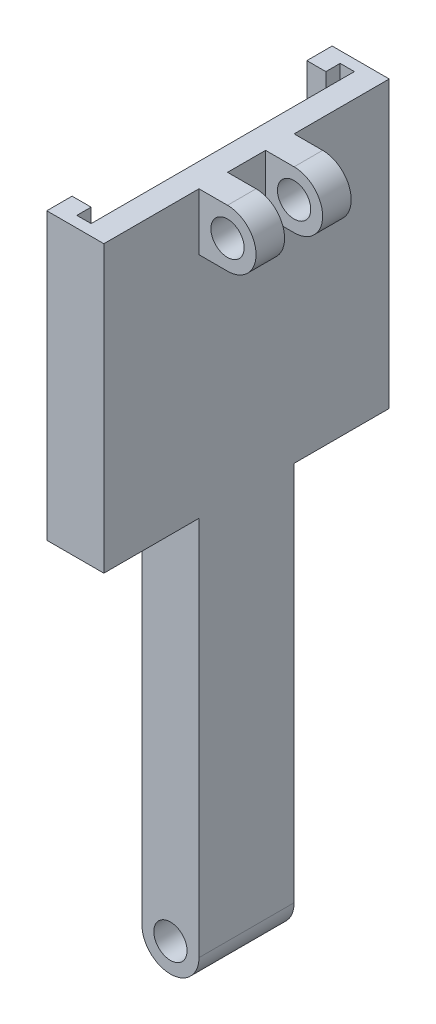
from build123d import *

# Parameters (mm, degrees)
SKETCH1_R           = 1.75
BOSS_EXTRUDE1_DEPTH = 10
SKETCH2_W           = 30
SKETCH2_H           = 30
BOSS_EXTRUDE2_DEPTH = 6
SKETCH3_W           = 2
SKETCH3_H           = 24.678853852
CUT_EXTRUDE1_DEPTH  = 28
BOSS_EXTRUDE3_DEPTH = 10
SKETCH5_W           = 6
SKETCH5_H           = 4
CUT_EXTRUDE2_DEPTH  = 6


with BuildPart() as part:
    # Sketch1 → Boss-Extrude1 (new body)
    with BuildSketch(Plane.XY):
        with BuildLine():
            ThreePointArc((-3, 0), (0, -3), (3, 0))
            Line((3, 0), (3, 70))
            Line((3, 70), (-3, 70))
            Line((-3, 70), (-3, 0))
        make_face()
        Circle(SKETCH1_R, mode=Mode.SUBTRACT)
    extrude(amount=BOSS_EXTRUDE1_DEPTH)

    # Sketch2 → Boss-Extrude2 (add)
    with BuildSketch(Plane.ZY.offset(3)):
        with Locations((5, 55)):
            Rectangle(SKETCH2_W, SKETCH2_H)
    extrude(amount=-BOSS_EXTRUDE2_DEPTH)

    # Sketch3 → Cut-Extrude1 (cut)
    with BuildSketch(Plane(origin=(0, 70, 0), x_dir=(1, 0, 0), z_dir=(0, 1, 0))):
        with Locations((-2, -5)):
            Rectangle(SKETCH3_W, SKETCH3_H)
        Polygon((-1, 8.839426926), (-1, 7.339426926), (-1, -17.339426926), (-1, -18.839426926), (0.5, -18.839426926), (0.5, 8.839426926), align=None)
    extrude(amount=-CUT_EXTRUDE1_DEPTH, mode=Mode.SUBTRACT)

    # Sketch4 → Boss-Extrude3 (add)
    with BuildSketch(Plane.XY.offset(10)):
        with BuildLine():
            ThreePointArc((9, 67), (8.121320344, 69.121320344), (6, 70))
            Line((6, 70), (6, 68.75))
            ThreePointArc((6, 68.75), (7.237436867, 68.237436867), (7.75, 67))
            ThreePointArc((7.75, 67), (7.237436867, 65.762563133), (6, 65.25))
            Line((6, 65.25), (6, 64))
            ThreePointArc((6, 64), (8.121320344, 64.878679656), (9, 67))
        make_face()
        with BuildLine():
            Line((6, 68.75), (6, 70))
            ThreePointArc((6, 70), (3.878679658, 69.121320346), (3, 67.000000006))
            ThreePointArc((3, 67.000000006), (3.878679654, 64.878679658), (6, 64))
            Line((6, 64), (6, 65.25))
            ThreePointArc((6, 65.25), (4.25, 67), (6, 68.75))
        make_face()
        with BuildLine():
            ThreePointArc((3, 67.000000006), (3.878679658, 69.121320346), (6, 70))
            Line((6, 70), (3, 70))
            Line((3, 70), (3, 67.000000006))
        make_face()
        with BuildLine():
            ThreePointArc((6, 64), (3.878679654, 64.878679658), (3, 67.000000006))
            Line((3, 67.000000006), (3, 64))
            Line((3, 64), (6, 64))
        make_face()
    extrude(amount=-BOSS_EXTRUDE3_DEPTH)

    # Sketch5 → Cut-Extrude2 (cut)
    with BuildSketch(Plane(origin=(0, 70, 0), x_dir=(1, 0, 0), z_dir=(0, 1, 0))):
        with Locations((6, -5)):
            Rectangle(SKETCH5_W, SKETCH5_H)
    extrude(amount=-CUT_EXTRUDE2_DEPTH, mode=Mode.SUBTRACT)


solid = part.part
